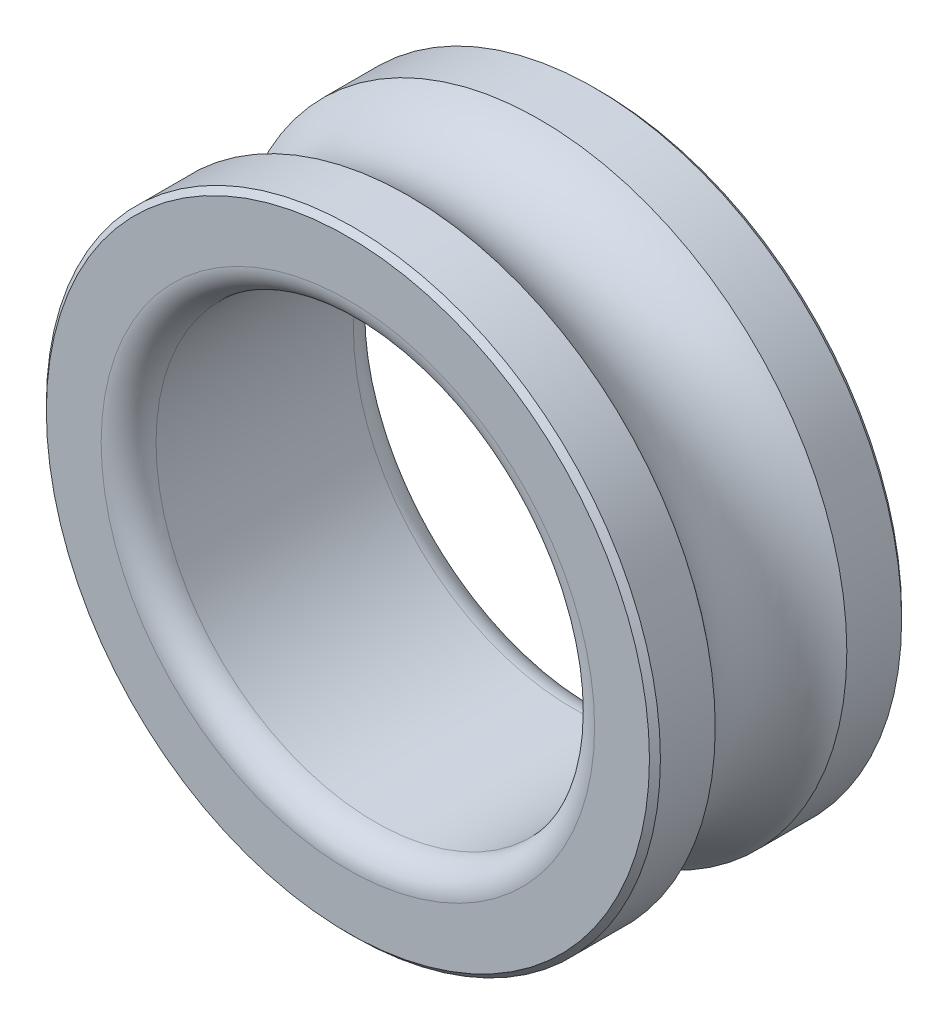
from build123d import *

# Parameters (mm, degrees)
SKETCH1_R           = 28
SKETCH1_R_2         = 20
BOSS_EXTRUDE1_DEPTH = 11.5
SKETCH3_R           = 7.5
CHAMFER1_SIZE       = 0.5
FILLET1_R           = 2.5


with BuildPart() as part:
    # Sketch1 → Boss-Extrude1 (new, symmetric)
    with BuildSketch(Plane.XY):
        Circle(SKETCH1_R)
        Circle(SKETCH1_R_2, mode=Mode.SUBTRACT)
    extrude(amount=BOSS_EXTRUDE1_DEPTH, both=True)

    # Sketch3 → Cut-Revolve1 (revolve, cut)
    with BuildSketch(Plane(origin=(0, 0, 0), x_dir=(1, 0, 0), z_dir=(0, 1, 0))):
        with Locations((32.5, 0)):
            Circle(SKETCH3_R)
    revolve(axis=Axis((0, 0, 0), (0, 0, -1)), mode=Mode.SUBTRACT)

    # Chamfer1
    chamfer1_edges = [part.edges().sort_by_distance(p)[0] for p in [
        (-28, 0, -11.5),
        (-28, 0, 11.5),
    ]]
    chamfer(chamfer1_edges, length=CHAMFER1_SIZE)

    # Fillet1
    fillet1_edges = [part.edges().sort_by_distance(p)[0] for p in [
        (-20, 0, -11.5),
        (-20, 0, 11.5),
    ]]
    fillet(fillet1_edges, radius=FILLET1_R)


solid = part.part
